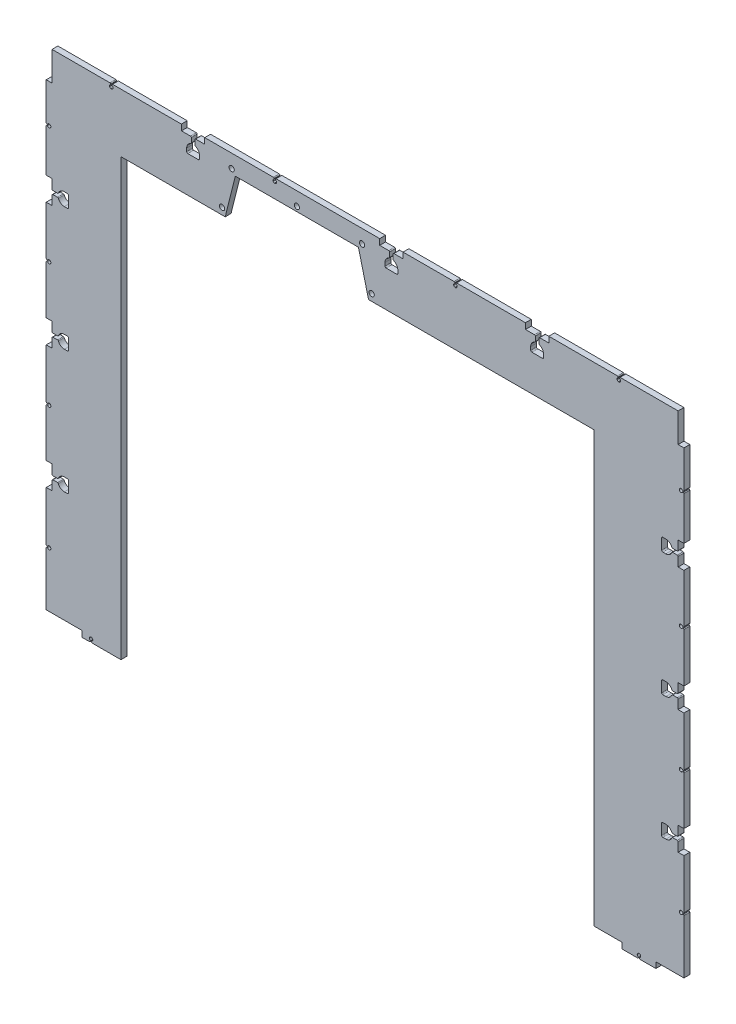
from build123d import *

# Parameters (mm, degrees)
MODEL_R             = 2.249999999
BOSS_EXTRUDE1_DEPTH = 5


with BuildPart() as part:
    # Model → Boss-Extrude1 (new body)
    with BuildSketch(Plane.XY):
        with BuildLine():
            Line((261.307383373, -103.940251976), (291.794615695, -103.940251976))
            Line((291.794615695, -103.940251976), (300.418939293, -138.440626737))
            Line((300.418939293, -138.440626737), (493.467327761, -138.440548814))
            add(Edge.make_bspline(
                [(493.467329423, -506.440295074), (493.467327381, -138.44081783), (493.467327761, -138.440548814)],
                knots=[0, 0, 0, 1, 1, 1], degree=2))
            Line((493.467329423, -506.440295074), (517.493608695, -506.440295074))
            Line((517.493608695, -506.440295074), (517.493608695, -511.440298825))
            Line((517.493608695, -511.440298825), (530.837127105, -511.440298825))
            add(Edge.make_bspline(
                [(531.482013256, -510.796321179), (531.481511649, -511.152126974), (531.192933254, -511.440298825), (530.837127105, -511.440298825)],
                knots=[110, 110, 110, 110, 111, 111, 111, 111], degree=3))
            Line((531.482013256, -510.796321179), (531.482072162, -510.754536748))
            add(Edge.make_bspline(
                [(531.159397004, -510.195408521), (531.352323759, -510.321972355), (531.482397448, -510.523800902), (531.482072162, -510.754536748)],
                knots=[108, 108, 108, 108, 109, 109, 109, 109], degree=3))
            add(Edge.make_bspline(
                [(530.481105329, -508.940296373), (530.481105328, -509.465362542), (530.750887098, -509.927417802), (531.159397004, -510.195408521)],
                knots=[107, 107, 107, 107, 108, 108, 108, 108], degree=3))
            add(Edge.make_bspline(
                [(532.34493913, -507.483075338), (531.358668083, -507.251275912), (530.481105343, -507.993303257), (530.481105329, -508.940296373)],
                knots=[106, 106, 106, 106, 107, 107, 107, 107], degree=3))
            add(Edge.make_bspline(
                [(533.431103461, -508.546960012), (533.298342158, -508.024781271), (532.869439285, -507.606346536), (532.34493913, -507.483075338)],
                knots=[105, 105, 105, 105, 106, 106, 106, 106], degree=3))
            add(Edge.make_bspline(
                [(532.797020473, -510.199189924), (533.308675637, -509.866894504), (533.605051988, -509.231137028), (533.431103461, -508.546960012)],
                knots=[104, 104, 104, 104, 105, 105, 105, 105], degree=3))
            add(Edge.make_bspline(
                [(532.471305327, -510.743247339), (532.477061026, -510.517354827), (532.60751342, -510.322265641), (532.797020473, -510.199189924)],
                knots=[103, 103, 103, 103, 104, 104, 104, 104], degree=3))
            Line((532.471305327, -510.743247339), (532.470394718, -510.77898577))
            add(Edge.make_bspline(
                [(533.115072274, -511.440298825), (532.752478529, -511.440298825), (532.461158895, -511.14146187), (532.470394718, -510.77898577)],
                knots=[101, 101, 101, 101, 102, 102, 102, 102], degree=3))
            Line((533.115072274, -511.440298825), (546.441040064, -511.440298825))
            Line((546.441040064, -511.440298825), (546.441040064, -506.440295074))
            Line((546.441040064, -506.440295074), (570.467319336, -506.440295074))
            Line((570.467319336, -506.440295074), (570.467319336, -460.230990761))
            add(Edge.make_bspline(
                [(569.823341689, -459.586104611), (570.179147485, -459.586606217), (570.467319336, -459.875184612), (570.467319336, -460.230990761)],
                knots=[96, 96, 96, 96, 97, 97, 97, 97], degree=3))
            Line((569.823341689, -459.586104611), (569.781557259, -459.586045704))
            add(Edge.make_bspline(
                [(569.222429032, -459.908720862), (569.348992865, -459.715794108), (569.550821413, -459.585720418), (569.781557259, -459.586045704)],
                knots=[94, 94, 94, 94, 95, 95, 95, 95], degree=3))
            add(Edge.make_bspline(
                [(567.967316884, -460.587012538), (568.492383052, -460.587012538), (568.954438313, -460.317230769), (569.222429032, -459.908720862)],
                knots=[93, 93, 93, 93, 94, 94, 94, 94], degree=3))
            add(Edge.make_bspline(
                [(566.510095848, -458.723178737), (566.278296423, -459.709449783), (567.020323768, -460.587012523), (567.967316884, -460.587012538)],
                knots=[92, 92, 92, 92, 93, 93, 93, 93], degree=3))
            add(Edge.make_bspline(
                [(567.573980523, -457.637014405), (567.051801782, -457.769775708), (566.633367046, -458.198678582), (566.510095848, -458.723178737)],
                knots=[91, 91, 91, 91, 92, 92, 92, 92], degree=3))
            add(Edge.make_bspline(
                [(569.226210435, -458.271097394), (568.893915014, -457.75944223), (568.258157539, -457.463065879), (567.573980523, -457.637014405)],
                knots=[90, 90, 90, 90, 91, 91, 91, 91], degree=3))
            add(Edge.make_bspline(
                [(569.77026785, -458.59681254), (569.544375337, -458.59105684), (569.349286151, -458.460604447), (569.226210435, -458.271097394)],
                knots=[89, 89, 89, 89, 90, 90, 90, 90], degree=3))
            Line((569.77026785, -458.59681254), (569.80600628, -458.597723148))
            add(Edge.make_bspline(
                [(570.467319336, -457.953045593), (570.467319335, -458.315639337), (570.168482381, -458.606958972), (569.80600628, -458.597723148)],
                knots=[87, 87, 87, 87, 88, 88, 88, 88], degree=3))
            Line((570.467319336, -457.953045593), (570.467319336, -415.690300813))
            Line((570.467319336, -415.690300813), (565.467315585, -415.690300813))
            Line((565.467315585, -415.690300813), (565.467315585, -407.940476253))
            add(Edge.make_bspline(
                [(564.717135104, -407.190476274), (565.131419139, -407.19037658), (565.467315585, -407.526192207), (565.467315585, -407.940476253)],
                knots=[83, 83, 83, 83, 84, 84, 84, 84], degree=3))
            Line((564.717135104, -407.190476274), (560.792410444, -407.191420726))
            add(Edge.make_bspline(
                [(560.098330941, -407.667876249), (560.209281691, -407.380879009), (560.484713812, -407.191937929), (560.792410444, -407.191420726)],
                knots=[81, 81, 81, 81, 82, 82, 82, 82], degree=3))
            add(Edge.make_bspline(
                [(554.967023746, -411.190296429), (557.296258818, -411.190750194), (559.299688603, -409.723730217), (560.098330941, -407.667876249)],
                knots=[80, 80, 80, 80, 81, 81, 81, 81], degree=3))
            Line((554.967023746, -411.190296429), (552.367350814, -411.190296429))
            add(Edge.make_bspline(
                [(551.367350815, -410.190296429), (551.367350814, -410.742581179), (551.815066064, -411.190296429), (552.367350814, -411.190296429)],
                knots=[78, 78, 78, 78, 79, 79, 79, 79], degree=3))
            Line((551.367350815, -410.190296429), (551.367350815, -401.190296432))
            add(Edge.make_bspline(
                [(552.367350815, -400.190296432), (551.815066066, -400.190296432), (551.367350815, -400.638011682), (551.367350815, -401.190296432)],
                knots=[76, 76, 76, 76, 77, 77, 77, 77], degree=3))
            Line((552.367350815, -400.190296432), (554.967023748, -400.190296432))
            add(Edge.make_bspline(
                [(560.09867297, -403.713453342), (559.300215856, -401.657193959), (557.296556675, -400.189819001), (554.967023748, -400.190296432)],
                knots=[74, 74, 74, 74, 75, 75, 75, 75], degree=3))
            add(Edge.make_bspline(
                [(560.792910551, -404.190085283), (560.485111766, -404.189605123), (560.209594602, -404.000571287), (560.09867297, -403.713453342)],
                knots=[73, 73, 73, 73, 74, 74, 74, 74], degree=3))
            Line((560.792910551, -404.190085283), (564.717281798, -404.190262075))
            add(Edge.make_bspline(
                [(565.467315585, -403.440262076), (565.467315584, -403.854488833), (565.131508554, -404.190280735), (564.717281798, -404.190262075)],
                knots=[71, 71, 71, 71, 72, 72, 72, 72], degree=3))
            Line((565.467315585, -403.440262076), (565.467315585, -395.690292049))
            Line((565.467315585, -395.690292049), (570.467319336, -395.690292049))
            Line((570.467319336, -395.690292049), (570.467319336, -354.480989822))
            add(Edge.make_bspline(
                [(569.823341689, -353.836103671), (570.179147485, -353.836605277), (570.467319336, -354.125183673), (570.467319336, -354.480989822)],
                knots=[67, 67, 67, 67, 68, 68, 68, 68], degree=3))
            Line((569.823341689, -353.836103671), (569.781557259, -353.836044764))
            add(Edge.make_bspline(
                [(569.222429032, -354.158719922), (569.348992865, -353.965793168), (569.550821413, -353.835719479), (569.781557259, -353.836044764)],
                knots=[65, 65, 65, 65, 66, 66, 66, 66], degree=3))
            add(Edge.make_bspline(
                [(567.967316884, -354.837011598), (568.492383052, -354.837011598), (568.954438313, -354.567229829), (569.222429032, -354.158719922)],
                knots=[64, 64, 64, 64, 65, 65, 65, 65], degree=3))
            add(Edge.make_bspline(
                [(566.510093031, -352.97318), (566.278295097, -353.959451397), (567.020323768, -354.837013015), (567.967316884, -354.837011598)],
                knots=[63, 63, 63, 63, 64, 64, 64, 64], degree=3))
            add(Edge.make_bspline(
                [(567.573980523, -351.887018428), (567.051801438, -352.019778376), (566.633365589, -352.448680165), (566.510093031, -352.97318)],
                knots=[62, 62, 62, 62, 63, 63, 63, 63], degree=3))
            add(Edge.make_bspline(
                [(569.226210435, -352.521101417), (568.893915014, -352.009446253), (568.258157539, -351.713069901), (567.573980523, -351.887018428)],
                knots=[61, 61, 61, 61, 62, 62, 62, 62], degree=3))
            add(Edge.make_bspline(
                [(569.77026785, -352.846816562), (569.544375337, -352.841060863), (569.349286151, -352.71060847), (569.226210435, -352.521101417)],
                knots=[60, 60, 60, 60, 61, 61, 61, 61], degree=3))
            Line((569.77026785, -352.846816562), (569.80600628, -352.847727171))
            add(Edge.make_bspline(
                [(570.467319336, -352.203049615), (570.467319335, -352.56564336), (570.168482381, -352.856962994), (569.80600628, -352.847727171)],
                knots=[58, 58, 58, 58, 59, 59, 59, 59], degree=3))
            Line((570.467319336, -352.203049615), (570.467319336, -309.940304836))
            Line((570.467319336, -309.940304836), (565.467315585, -309.940304836))
            Line((565.467315585, -309.940304836), (565.467315585, -302.190480276))
            add(Edge.make_bspline(
                [(564.717135106, -301.440480295), (565.13141914, -301.440380602), (565.467315586, -301.776196229), (565.467315585, -302.190480276)],
                knots=[54, 54, 54, 54, 55, 55, 55, 55], degree=3))
            Line((564.717135106, -301.440480295), (560.792410444, -301.441417852))
            add(Edge.make_bspline(
                [(560.098330941, -301.917873374), (560.209281691, -301.630876135), (560.484713812, -301.441935055), (560.792410444, -301.441417852)],
                knots=[52, 52, 52, 52, 53, 53, 53, 53], degree=3))
            add(Edge.make_bspline(
                [(554.967023746, -305.440293555), (557.296258818, -305.44074732), (559.299688603, -303.973727343), (560.098330941, -301.917873374)],
                knots=[51, 51, 51, 51, 52, 52, 52, 52], degree=3))
            Line((554.967023746, -305.440293555), (552.367350814, -305.440293555))
            add(Edge.make_bspline(
                [(551.367350815, -304.440293555), (551.367350814, -304.992578304), (551.815066064, -305.440293555), (552.367350814, -305.440293555)],
                knots=[49, 49, 49, 49, 50, 50, 50, 50], degree=3))
            Line((551.367350815, -304.440293555), (551.367350815, -295.440293557))
            add(Edge.make_bspline(
                [(552.367357712, -294.440300455), (551.815072963, -294.440296646), (551.367354624, -294.888008808), (551.367350815, -295.440293557)],
                knots=[47, 47, 47, 47, 48, 48, 48, 48], degree=3))
            Line((552.367357712, -294.440300455), (554.967030644, -294.440300455))
            add(Edge.make_bspline(
                [(560.098679867, -297.963457364), (559.300222753, -295.907197982), (557.296563571, -294.439823024), (554.967030644, -294.440300455)],
                knots=[45, 45, 45, 45, 46, 46, 46, 46], degree=3))
            add(Edge.make_bspline(
                [(560.792917448, -298.440089305), (560.485118663, -298.439609146), (560.209601499, -298.250575309), (560.098679867, -297.963457364)],
                knots=[44, 44, 44, 44, 45, 45, 45, 45], degree=3))
            Line((560.792917448, -298.440089305), (564.717288694, -298.440266098))
            add(Edge.make_bspline(
                [(565.467315585, -297.690259202), (565.467319394, -298.104485959), (565.131515451, -298.440280949), (564.717288694, -298.440266098)],
                knots=[42, 42, 42, 42, 43, 43, 43, 43], degree=3))
            Line((565.467315585, -297.690259202), (565.467315585, -289.940289175))
            Line((565.467315585, -289.940289175), (570.467319336, -289.940289175))
            Line((570.467319336, -289.940289175), (570.467319336, -248.105989517))
            add(Edge.make_bspline(
                [(569.823341689, -247.461103366), (570.179147485, -247.461604972), (570.467319336, -247.750183368), (570.467319336, -248.105989517)],
                knots=[38, 38, 38, 38, 39, 39, 39, 39], degree=3))
            Line((569.823341689, -247.461103366), (569.781557259, -247.461044459))
            add(Edge.make_bspline(
                [(569.222429032, -247.783719617), (569.348992865, -247.590792863), (569.550821413, -247.460719174), (569.781557259, -247.461044459)],
                knots=[36, 36, 36, 36, 37, 37, 37, 37], degree=3))
            add(Edge.make_bspline(
                [(567.967316884, -248.462011293), (568.492383052, -248.462011293), (568.954438313, -248.192229524), (569.222429032, -247.783719617)],
                knots=[35, 35, 35, 35, 36, 36, 36, 36], degree=3))
            add(Edge.make_bspline(
                [(566.510095848, -246.598177492), (566.278296423, -247.584448539), (567.020323768, -248.462011279), (567.967316884, -248.462011293)],
                knots=[34, 34, 34, 34, 35, 35, 35, 35], degree=3))
            add(Edge.make_bspline(
                [(567.573980523, -245.512013161), (567.051801782, -245.644774463), (566.633367046, -246.073677337), (566.510095848, -246.598177492)],
                knots=[33, 33, 33, 33, 34, 34, 34, 34], degree=3))
            add(Edge.make_bspline(
                [(569.226210435, -246.146096149), (568.893915014, -245.634440985), (568.258157539, -245.338064634), (567.573980523, -245.512013161)],
                knots=[32, 32, 32, 32, 33, 33, 33, 33], degree=3))
            add(Edge.make_bspline(
                [(569.77026785, -246.471811295), (569.544375337, -246.466055596), (569.349286151, -246.335603202), (569.226210435, -246.146096149)],
                knots=[31, 31, 31, 31, 32, 32, 32, 32], degree=3))
            Line((569.77026785, -246.471811295), (569.80600628, -246.472721903))
            add(Edge.make_bspline(
                [(570.467319336, -245.828044348), (570.467319335, -246.190638093), (570.168482381, -246.481957727), (569.80600628, -246.472721903)],
                knots=[29, 29, 29, 29, 30, 30, 30, 30], degree=3))
            Line((570.467319336, -245.828044348), (570.467319336, -204.190304485))
            Line((570.467319336, -204.190304485), (565.467315585, -204.190304485))
            Line((565.467315585, -204.190304485), (565.467315585, -196.440479925))
            add(Edge.make_bspline(
                [(564.717135105, -195.690479945), (565.131419139, -195.690380252), (565.467315586, -196.026195879), (565.467315585, -196.440479925)],
                knots=[25, 25, 25, 25, 26, 26, 26, 26], degree=3))
            Line((564.717135105, -195.690479945), (560.792410444, -195.69142137))
            add(Edge.make_bspline(
                [(560.098330941, -196.167876893), (560.209281691, -195.880879653), (560.484713812, -195.691938573), (560.792410444, -195.69142137)],
                knots=[23, 23, 23, 23, 24, 24, 24, 24], degree=3))
            add(Edge.make_bspline(
                [(554.967023746, -199.690297073), (557.296258818, -199.690750838), (559.299688603, -198.223730861), (560.098330941, -196.167876893)],
                knots=[22, 22, 22, 22, 23, 23, 23, 23], degree=3))
            Line((554.967023746, -199.690297073), (552.367350814, -199.690297073))
            add(Edge.make_bspline(
                [(551.367350815, -198.690297073), (551.367350814, -199.242581823), (551.815066064, -199.690297073), (552.367350814, -199.690297073)],
                knots=[20, 20, 20, 20, 21, 21, 21, 21], degree=3))
            Line((551.367350815, -198.690297073), (551.367350815, -189.690297076))
            add(Edge.make_bspline(
                [(552.367353843, -188.690300104), (551.815069094, -188.690298432), (551.367352487, -189.138012326), (551.367350815, -189.690297076)],
                knots=[18, 18, 18, 18, 19, 19, 19, 19], degree=3))
            Line((552.367353843, -188.690300104), (554.967026775, -188.690300104))
            add(Edge.make_bspline(
                [(560.098675998, -192.213457014), (559.300218884, -190.157197631), (557.296559703, -188.689822673), (554.967026775, -188.690300104)],
                knots=[16, 16, 16, 16, 17, 17, 17, 17], degree=3))
            add(Edge.make_bspline(
                [(560.792913579, -192.690088955), (560.485114794, -192.689608795), (560.20959763, -192.500574959), (560.098675998, -192.213457014)],
                knots=[15, 15, 15, 15, 16, 16, 16, 16], degree=3))
            Line((560.792913579, -192.690088955), (564.717284826, -192.690265747))
            add(Edge.make_bspline(
                [(565.467315585, -191.94026272), (565.467317257, -192.354489477), (565.131511582, -192.690282735), (564.717284826, -192.690265747)],
                knots=[13, 13, 13, 13, 14, 14, 14, 14], degree=3))
            Line((565.467315585, -191.94026272), (565.467315585, -184.190292693))
            Line((565.467315585, -184.190292693), (570.467319336, -184.190292693))
            Line((570.467319336, -184.190292693), (570.467319336, -147.355988462))
            add(Edge.make_bspline(
                [(569.823341689, -146.711102312), (570.179147485, -146.711603918), (570.467319336, -147.000182314), (570.467319336, -147.355988462)],
                knots=[9, 9, 9, 9, 10, 10, 10, 10], degree=3))
            Line((569.823341689, -146.711102312), (569.781557259, -146.711043405))
            add(Edge.make_bspline(
                [(569.222429032, -147.033718563), (569.348992865, -146.840791809), (569.550821413, -146.710718119), (569.781557259, -146.711043405)],
                knots=[7, 7, 7, 7, 8, 8, 8, 8], degree=3))
            add(Edge.make_bspline(
                [(567.967316884, -147.712010239), (568.492383052, -147.712010239), (568.954438313, -147.44222847), (569.222429032, -147.033718563)],
                knots=[6, 6, 6, 6, 7, 7, 7, 7], degree=3))
            add(Edge.make_bspline(
                [(566.510095848, -145.848176438), (566.278296423, -146.834447485), (567.020323768, -147.712010225), (567.967316884, -147.712010239)],
                knots=[5, 5, 5, 5, 6, 6, 6, 6], degree=3))
            add(Edge.make_bspline(
                [(567.573980523, -144.762012107), (567.051801782, -144.894773409), (566.633367046, -145.323676283), (566.510095848, -145.848176438)],
                knots=[4, 4, 4, 4, 5, 5, 5, 5], degree=3))
            add(Edge.make_bspline(
                [(569.226210435, -145.396095095), (568.893915014, -144.884439931), (568.258157539, -144.58806358), (567.573980523, -144.762012107)],
                knots=[3, 3, 3, 3, 4, 4, 4, 4], degree=3))
            add(Edge.make_bspline(
                [(569.77026785, -145.721810241), (569.544375337, -145.716054542), (569.349286151, -145.585602148), (569.226210435, -145.396095095)],
                knots=[2, 2, 2, 2, 3, 3, 3, 3], degree=3))
            Line((569.77026785, -145.721810241), (569.80600628, -145.722720849))
            add(Edge.make_bspline(
                [(570.467319336, -145.078043294), (570.467319335, -145.440637039), (570.168482381, -145.731956673), (569.80600628, -145.722720849)],
                knots=[0, 0, 0, 0, 1, 1, 1, 1], degree=3))
            Line((570.467319336, -145.078043294), (570.467319336, -113.388526066))
            Line((570.467319336, -113.388526066), (565.467315585, -113.388526066))
            Line((565.467315585, -113.388526066), (565.467315585, -88.440292958))
            Line((565.467315585, -88.440292958), (515.847502835, -88.440292958))
            add(Edge.make_bspline(
                [(515.847502835, -88.440292958), (515.491696686, -88.440292958), (515.203118291, -88.728464809), (515.202616685, -89.084270604)],
                knots=[0, 0, 0, 0, 1, 1, 1, 1], degree=3))
            Line((515.202616685, -89.084270604), (515.202557778, -89.126055035))
            add(Edge.make_bspline(
                [(515.202557778, -89.126055035), (515.202232492, -89.356790881), (515.332306182, -89.558619428), (515.525232936, -89.685183262)],
                knots=[2, 2, 2, 2, 3, 3, 3, 3], degree=3))
            add(Edge.make_bspline(
                [(515.525232936, -89.685183262), (515.933742843, -89.953173981), (516.203524612, -90.415229241), (516.203524612, -90.94029541)],
                knots=[3, 3, 3, 3, 4, 4, 4, 4], degree=3))
            add(Edge.make_bspline(
                [(516.203524612, -90.94029541), (516.203524598, -91.887288525), (515.325961858, -92.62931587), (514.339690811, -92.397516445)],
                knots=[4, 4, 4, 4, 5, 5, 5, 5], degree=3))
            add(Edge.make_bspline(
                [(514.339690811, -92.397516445), (513.815190656, -92.274245247), (513.386287782, -91.855810511), (513.25352648, -91.333631771)],
                knots=[5, 5, 5, 5, 6, 6, 6, 6], degree=3))
            add(Edge.make_bspline(
                [(513.25352648, -91.333631771), (513.079577953, -90.649454755), (513.375954304, -90.013697279), (513.887609468, -89.681401859)],
                knots=[6, 6, 6, 6, 7, 7, 7, 7], degree=3))
            add(Edge.make_bspline(
                [(513.887609468, -89.681401859), (514.077116521, -89.558326142), (514.207568914, -89.363236956), (514.213324614, -89.137344444)],
                knots=[7, 7, 7, 7, 8, 8, 8, 8], degree=3))
            Line((514.213324614, -89.137344444), (514.214235222, -89.101606013))
            add(Edge.make_bspline(
                [(514.214235222, -89.101606013), (514.223471046, -88.739129913), (513.932151411, -88.440292958), (513.569557666, -88.440292958)],
                knots=[9, 9, 9, 9, 10, 10, 10, 10], degree=3))
            Line((513.569557666, -88.440292958), (454.740916037, -88.440292958))
            Line((454.740916037, -88.440292958), (454.740916037, -93.440296709))
            Line((454.740916037, -93.440296709), (446.991091477, -93.440296709))
            add(Edge.make_bspline(
                [(446.991091477, -93.440296709), (446.57680743, -93.44029671), (446.240991805, -93.776193157), (446.2410915, -94.190477192)],
                knots=[13, 13, 13, 13, 14, 14, 14, 14], degree=3))
            Line((446.2410915, -94.190477192), (446.242035952, -98.115201852))
            add(Edge.make_bspline(
                [(446.242035952, -98.115201852), (446.242109997, -98.422899229), (446.430654388, -98.698603471), (446.717491832, -98.809967567)],
                knots=[15, 15, 15, 15, 16, 16, 16, 16], degree=3))
            add(Edge.make_bspline(
                [(446.717491832, -98.809967567), (448.773501386, -99.608209398), (450.240911657, -101.611353387), (450.240911658, -103.940588548)],
                knots=[16, 16, 16, 16, 17, 17, 17, 17], degree=3))
            Line((450.240911658, -103.940588548), (450.240911658, -106.54026148))
            add(Edge.make_bspline(
                [(450.240911658, -106.54026148), (450.240911658, -107.09254623), (449.793196408, -107.54026148), (449.240911658, -107.54026148)],
                knots=[18, 18, 18, 18, 19, 19, 19, 19], degree=3))
            Line((449.240911658, -107.54026148), (440.240911661, -107.54026148))
            add(Edge.make_bspline(
                [(440.240911661, -107.54026148), (439.688626911, -107.54026148), (439.240911661, -107.09254623), (439.240911661, -106.54026148)],
                knots=[20, 20, 20, 20, 21, 21, 21, 21], degree=3))
            Line((439.240911661, -106.54026148), (439.240911661, -103.940588548))
            add(Edge.make_bspline(
                [(439.240911661, -103.940588548), (439.240434229, -101.611055621), (440.707809186, -99.607396438), (442.764068568, -98.808939323)],
                knots=[22, 22, 22, 22, 23, 23, 23, 23], degree=3))
            add(Edge.make_bspline(
                [(442.764068568, -98.808939323), (443.051186513, -98.698017691), (443.240220349, -98.422500527), (443.240700509, -98.114701742)],
                knots=[23, 23, 23, 23, 24, 24, 24, 24], degree=3))
            Line((443.240700509, -98.114701742), (443.240877299, -94.190330496))
            add(Edge.make_bspline(
                [(443.240877299, -94.190330496), (443.240895959, -93.776103739), (442.905104057, -93.440296709), (442.4908773, -93.440296709)],
                knots=[25, 25, 25, 25, 26, 26, 26, 26], degree=3))
            Line((442.4908773, -93.440296709), (434.740907273, -93.440296709))
            Line((434.740907273, -93.440296709), (434.740907273, -88.440292958))
            Line((434.740907273, -88.440292958), (375.894710946, -88.38852732))
            add(Edge.make_bspline(
                [(375.894710946, -88.38852732), (375.538904797, -88.388527319), (375.250326402, -88.676699171), (375.249824796, -89.032504966)],
                knots=[29, 29, 29, 29, 30, 30, 30, 30], degree=3))
            Line((375.249824796, -89.032504966), (375.249765889, -89.074289396))
            add(Edge.make_bspline(
                [(375.249765889, -89.074289396), (375.249440603, -89.305025242), (375.379514293, -89.50685379), (375.572441047, -89.633417623)],
                knots=[31, 31, 31, 31, 32, 32, 32, 32], degree=3))
            add(Edge.make_bspline(
                [(375.572441047, -89.633417623), (375.980950954, -89.901408343), (376.250732723, -90.363463603), (376.250732723, -90.888529771)],
                knots=[32, 32, 32, 32, 33, 33, 33, 33], degree=3))
            add(Edge.make_bspline(
                [(376.250732723, -90.888529771), (376.250732709, -91.835522887), (375.373169969, -92.577550232), (374.386898922, -92.345750807)],
                knots=[33, 33, 33, 33, 34, 34, 34, 34], degree=3))
            add(Edge.make_bspline(
                [(374.386898922, -92.345750807), (373.862398767, -92.222479609), (373.433495893, -91.804044873), (373.300734591, -91.281866132)],
                knots=[34, 34, 34, 34, 35, 35, 35, 35], degree=3))
            add(Edge.make_bspline(
                [(373.300734591, -91.281866132), (373.126786064, -90.597689116), (373.423162415, -89.961931641), (373.934817579, -89.62963622)],
                knots=[35, 35, 35, 35, 36, 36, 36, 36], degree=3))
            add(Edge.make_bspline(
                [(373.934817579, -89.62963622), (374.124324632, -89.506560504), (374.254777025, -89.311471318), (374.260532725, -89.085578805)],
                knots=[36, 36, 36, 36, 37, 37, 37, 37], degree=3))
            Line((374.260532725, -89.085578805), (374.261443333, -89.049840375))
            add(Edge.make_bspline(
                [(374.261443333, -89.049840375), (374.270679157, -88.687364274), (373.979359522, -88.38852732), (373.616765777, -88.38852732)],
                knots=[38, 38, 38, 38, 39, 39, 39, 39], degree=3))
            Line((373.616765777, -88.38852732), (329.968017059, -88.440292958))
            Line((329.968017059, -88.440292958), (329.968017059, -93.440296709))
            Line((329.968017059, -93.440296709), (322.21817954, -93.440296709))
            add(Edge.make_bspline(
                [(322.21817954, -93.440296709), (321.803895493, -93.44029671), (321.468079868, -93.776193157), (321.468179563, -94.190477192)],
                knots=[42, 42, 42, 42, 43, 43, 43, 43], degree=3))
            Line((321.468179563, -94.190477192), (321.469124015, -98.115201852))
            add(Edge.make_bspline(
                [(321.469124015, -98.115201852), (321.46919806, -98.422899229), (321.657742451, -98.698603471), (321.944579895, -98.809967567)],
                knots=[44, 44, 44, 44, 45, 45, 45, 45], degree=3))
            add(Edge.make_bspline(
                [(321.944579895, -98.809967567), (324.000589449, -99.608209398), (325.46799972, -101.611353387), (325.467999721, -103.940588548)],
                knots=[45, 45, 45, 45, 46, 46, 46, 46], degree=3))
            Line((325.467999721, -103.940588548), (325.467999721, -106.54026148))
            add(Edge.make_bspline(
                [(325.467999721, -106.54026148), (325.467999721, -107.09254623), (325.020284471, -107.54026148), (324.467999721, -107.54026148)],
                knots=[47, 47, 47, 47, 48, 48, 48, 48], degree=3))
            Line((324.467999721, -107.54026148), (315.467999724, -107.54026148))
            add(Edge.make_bspline(
                [(315.467999724, -107.54026148), (314.915714974, -107.54026148), (314.467999724, -107.09254623), (314.467999724, -106.54026148)],
                knots=[49, 49, 49, 49, 50, 50, 50, 50], degree=3))
            Line((314.467999724, -106.54026148), (314.467999724, -103.940588548))
            add(Edge.make_bspline(
                [(314.467999724, -103.940588548), (314.467522292, -101.611055621), (315.934897248, -99.607396438), (317.991156631, -98.808939323)],
                knots=[51, 51, 51, 51, 52, 52, 52, 52], degree=3))
            add(Edge.make_bspline(
                [(317.991156631, -98.808939323), (318.278274576, -98.698017691), (318.467308412, -98.422500527), (318.467788571, -98.114701742)],
                knots=[52, 52, 52, 52, 53, 53, 53, 53], degree=3))
            Line((318.467788571, -98.114701742), (318.467965361, -94.190330496))
            add(Edge.make_bspline(
                [(318.467965361, -94.190330496), (318.467984022, -93.776103739), (318.132192119, -93.440296709), (317.717965363, -93.440296709)],
                knots=[54, 54, 54, 54, 55, 55, 55, 55], degree=3))
            Line((317.717965363, -93.440296709), (309.968008801, -93.440296709))
            Line((309.968008801, -93.440296709), (309.968008801, -88.440292958))
            Line((309.968008801, -88.440292958), (259.896045785, -88.440292958))
            Line((259.896045785, -88.440292958), (221.300298589, -88.440292958))
            add(Edge.make_bspline(
                [(221.300298589, -88.440292958), (220.94449244, -88.440292958), (220.655914045, -88.728464809), (220.655412438, -89.084270604)],
                knots=[3, 3, 3, 3, 4, 4, 4, 4], degree=3))
            Line((220.655412438, -89.084270604), (220.655353532, -89.126055035))
            add(Edge.make_bspline(
                [(220.655353532, -89.126055035), (220.655028246, -89.356790881), (220.785101935, -89.558619428), (220.97802869, -89.685183262)],
                knots=[5, 5, 5, 5, 6, 6, 6, 6], degree=3))
            add(Edge.make_bspline(
                [(220.97802869, -89.685183262), (221.386538596, -89.953173981), (221.656320366, -90.415229241), (221.656320366, -90.94029541)],
                knots=[6, 6, 6, 6, 7, 7, 7, 7], degree=3))
            add(Edge.make_bspline(
                [(221.656320366, -90.94029541), (221.656320351, -91.887288525), (220.778757611, -92.62931587), (219.792486565, -92.397516445)],
                knots=[7, 7, 7, 7, 8, 8, 8, 8], degree=3))
            add(Edge.make_bspline(
                [(219.792486565, -92.397516445), (219.26798641, -92.274245247), (218.839083536, -91.855810511), (218.706322233, -91.333631771)],
                knots=[8, 8, 8, 8, 9, 9, 9, 9], degree=3))
            add(Edge.make_bspline(
                [(218.706322233, -91.333631771), (218.532373707, -90.649454755), (218.828750058, -90.013697279), (219.340405222, -89.681401859)],
                knots=[9, 9, 9, 9, 10, 10, 10, 10], degree=3))
            add(Edge.make_bspline(
                [(219.340405222, -89.681401859), (219.529912275, -89.558326142), (219.660364668, -89.363236956), (219.666120367, -89.137344444)],
                knots=[10, 10, 10, 10, 11, 11, 11, 11], degree=3))
            Line((219.666120367, -89.137344444), (219.667030976, -89.101606013))
            add(Edge.make_bspline(
                [(219.667030976, -89.101606013), (219.676266799, -88.739129913), (219.384947165, -88.440292958), (219.02235342, -88.440292958)],
                knots=[12, 12, 12, 12, 13, 13, 13, 13], degree=3))
            Line((219.02235342, -88.440292958), (160.193711791, -88.440292958))
            Line((160.193711791, -88.440292958), (160.193711791, -93.440296709))
            Line((160.193711791, -93.440296709), (152.443874271, -93.440296709))
            add(Edge.make_bspline(
                [(152.443874271, -93.440296709), (152.029590225, -93.44029671), (151.6937746, -93.776193157), (151.693874295, -94.190477192)],
                knots=[16, 16, 16, 16, 17, 17, 17, 17], degree=3))
            Line((151.693874295, -94.190477192), (151.694818747, -98.115201852))
            add(Edge.make_bspline(
                [(151.694818747, -98.115201852), (151.694892792, -98.422899229), (151.883437183, -98.698603471), (152.170274626, -98.809967567)],
                knots=[18, 18, 18, 18, 19, 19, 19, 19], degree=3))
            add(Edge.make_bspline(
                [(152.170274626, -98.809967567), (154.226284181, -99.608209398), (155.693694452, -101.611353387), (155.693694452, -103.940588548)],
                knots=[19, 19, 19, 19, 20, 20, 20, 20], degree=3))
            Line((155.693694452, -103.940588548), (155.693694452, -106.54026148))
            add(Edge.make_bspline(
                [(155.693694452, -106.54026148), (155.693694453, -107.09254623), (155.245979202, -107.54026148), (154.693694452, -107.54026148)],
                knots=[21, 21, 21, 21, 22, 22, 22, 22], degree=3))
            Line((154.693694452, -107.54026148), (145.693694455, -107.54026148))
            add(Edge.make_bspline(
                [(145.693694455, -107.54026148), (145.141409706, -107.54026148), (144.693694456, -107.09254623), (144.693694456, -106.54026148)],
                knots=[23, 23, 23, 23, 24, 24, 24, 24], degree=3))
            Line((144.693694456, -106.54026148), (144.693694456, -103.940588548))
            add(Edge.make_bspline(
                [(144.693694456, -103.940588548), (144.693694457, -101.611055523), (146.161480059, -99.607697076), (148.217903084, -98.809661387)],
                knots=[25, 25, 25, 25, 26, 26, 26, 26], degree=3))
            add(Edge.make_bspline(
                [(148.217903084, -98.809661387), (148.50485299, -98.698304792), (148.693469437, -98.422501254), (148.693483303, -98.114701742)],
                knots=[26, 26, 26, 26, 27, 27, 27, 27], degree=3))
            Line((148.693483303, -98.114701742), (148.693660093, -94.190330496))
            add(Edge.make_bspline(
                [(148.693660093, -94.190330496), (148.693678754, -93.776103739), (148.357886851, -93.440296709), (147.943660094, -93.440296709)],
                knots=[28, 28, 28, 28, 29, 29, 29, 29], degree=3))
            Line((147.943660094, -93.440296709), (140.193703533, -93.440296709))
            Line((140.193703533, -93.440296709), (140.193703533, -88.440292958))
            Line((140.193703533, -88.440292958), (81.347507206, -88.38852732))
            add(Edge.make_bspline(
                [(81.347507206, -88.38852732), (80.991701057, -88.388527319), (80.703122662, -88.676699171), (80.702621055, -89.032504966)],
                knots=[32, 32, 32, 32, 33, 33, 33, 33], degree=3))
            Line((80.702621055, -89.032504966), (80.702562149, -89.074289396))
            add(Edge.make_bspline(
                [(80.702562149, -89.074289396), (80.702236863, -89.305025242), (80.832310552, -89.50685379), (81.025237307, -89.633417623)],
                knots=[34, 34, 34, 34, 35, 35, 35, 35], degree=3))
            add(Edge.make_bspline(
                [(81.025237307, -89.633417623), (81.433747214, -89.901408343), (81.703528983, -90.363463603), (81.703528983, -90.888529771)],
                knots=[35, 35, 35, 35, 36, 36, 36, 36], degree=3))
            add(Edge.make_bspline(
                [(81.703528983, -90.888529771), (81.703528968, -91.835522887), (80.825966228, -92.577550232), (79.839695182, -92.345750807)],
                knots=[36, 36, 36, 36, 37, 37, 37, 37], degree=3))
            add(Edge.make_bspline(
                [(79.839695182, -92.345750807), (79.315195027, -92.222479609), (78.886292153, -91.804044873), (78.75353085, -91.281866132)],
                knots=[37, 37, 37, 37, 38, 38, 38, 38], degree=3))
            add(Edge.make_bspline(
                [(78.75353085, -91.281866132), (78.579582324, -90.597689116), (78.875958675, -89.961931641), (79.387613839, -89.62963622)],
                knots=[38, 38, 38, 38, 39, 39, 39, 39], degree=3))
            add(Edge.make_bspline(
                [(79.387613839, -89.62963622), (79.577120892, -89.506560504), (79.707573285, -89.311471318), (79.713328984, -89.085578805)],
                knots=[39, 39, 39, 39, 40, 40, 40, 40], degree=3))
            Line((79.713328984, -89.085578805), (79.714239593, -89.049840375))
            add(Edge.make_bspline(
                [(79.714239593, -89.049840375), (79.723475416, -88.687364274), (79.432155782, -88.38852732), (79.069562037, -88.38852732)],
                knots=[41, 41, 41, 41, 42, 42, 42, 42], degree=3))
            Line((79.069562037, -88.38852732), (29.467317209, -88.38852732))
            Line((29.467317209, -88.38852732), (29.467317209, -113.388526066))
            Line((29.467317209, -113.388526066), (24.467313458, -113.388526066))
            Line((24.467313458, -113.388526066), (24.467313458, -145.185096014))
            add(Edge.make_bspline(
                [(25.111291105, -145.829982164), (24.755485309, -145.829480558), (24.467313458, -145.540902162), (24.467313458, -145.185096014)],
                knots=[115, 115, 115, 115, 116, 116, 116, 116], degree=3))
            Line((25.111291105, -145.829982164), (25.153075535, -145.830041071))
            add(Edge.make_bspline(
                [(25.712203762, -145.507365913), (25.585639929, -145.700292667), (25.383811381, -145.830366357), (25.153075535, -145.830041071)],
                knots=[113, 113, 113, 113, 114, 114, 114, 114], degree=3))
            add(Edge.make_bspline(
                [(26.96731591, -144.829074237), (26.442249742, -144.829074237), (25.980194481, -145.098856006), (25.712203762, -145.507365913)],
                knots=[112, 112, 112, 112, 113, 113, 113, 113], degree=3))
            add(Edge.make_bspline(
                [(28.424536945, -146.692908038), (28.656336371, -145.706636991), (27.914309026, -144.829074251), (26.96731591, -144.829074237)],
                knots=[111, 111, 111, 111, 112, 112, 112, 112], degree=3))
            add(Edge.make_bspline(
                [(27.360652271, -147.779072369), (27.882831012, -147.646311067), (28.301265748, -147.217408193), (28.424536945, -146.692908038)],
                knots=[110, 110, 110, 110, 111, 111, 111, 111], degree=3))
            add(Edge.make_bspline(
                [(25.708422359, -147.144989381), (26.04071778, -147.656644545), (26.676475255, -147.953020896), (27.360652271, -147.779072369)],
                knots=[109, 109, 109, 109, 110, 110, 110, 110], degree=3))
            add(Edge.make_bspline(
                [(25.164364944, -146.819274235), (25.390257456, -146.825029934), (25.585346642, -146.955482328), (25.708422359, -147.144989381)],
                knots=[108, 108, 108, 108, 109, 109, 109, 109], degree=3))
            Line((25.164364944, -146.819274235), (25.128626513, -146.818363627))
            add(Edge.make_bspline(
                [(24.467313458, -147.463041182), (24.467313459, -147.100447437), (24.766150413, -146.809127803), (25.128626513, -146.818363627)],
                knots=[106, 106, 106, 106, 107, 107, 107, 107], degree=3))
            Line((24.467313458, -147.463041182), (24.467313458, -184.190292693))
            Line((24.467313458, -184.190292693), (29.467317209, -184.190292693))
            Line((29.467317209, -184.190292693), (29.467317209, -191.940117253))
            add(Edge.make_bspline(
                [(30.217497689, -192.690117233), (29.803213655, -192.690216926), (29.467317209, -192.3544013), (29.467317209, -191.940117253)],
                knots=[102, 102, 102, 102, 103, 103, 103, 103], degree=3))
            Line((30.217497689, -192.690117233), (34.142222351, -192.689175808))
            add(Edge.make_bspline(
                [(34.836988065, -192.213719929), (34.725623969, -192.500557372), (34.449919727, -192.689101763), (34.142222351, -192.689175808)],
                knots=[100, 100, 100, 100, 101, 101, 101, 101], degree=3))
            add(Edge.make_bspline(
                [(39.967609048, -188.690300104), (37.638373887, -188.690300104), (35.635229897, -190.157710374), (34.836988065, -192.213719929)],
                knots=[99, 99, 99, 99, 100, 100, 100, 100], degree=3))
            Line((39.967609048, -188.690300104), (42.56728198, -188.690300104))
            add(Edge.make_bspline(
                [(43.567281979, -189.690300105), (43.56728198, -189.138015355), (43.11956673, -188.690300105), (42.56728198, -188.690300104)],
                knots=[97, 97, 97, 97, 98, 98, 98, 98], degree=3))
            Line((43.567281979, -189.690300105), (43.567281979, -198.690300102))
            add(Edge.make_bspline(
                [(42.567278951, -199.690297073), (43.119563701, -199.690298746), (43.567280307, -199.242584852), (43.567281979, -198.690300102)],
                knots=[95, 95, 95, 95, 96, 96, 96, 96], degree=3))
            Line((42.567278951, -199.690297073), (39.967606019, -199.690297073))
            add(Edge.make_bspline(
                [(34.83667886, -196.166088443), (35.634714548, -198.222511468), (37.638072994, -199.690297071), (39.967606019, -199.690297073)],
                knots=[93, 93, 93, 93, 94, 94, 94, 94], degree=3))
            add(Edge.make_bspline(
                [(34.141719215, -195.690508224), (34.449518727, -195.69052209), (34.725322264, -195.879138537), (34.83667886, -196.166088443)],
                knots=[92, 92, 92, 92, 93, 93, 93, 93], degree=3))
            Line((34.141719215, -195.690508224), (30.217347968, -195.690331432))
            add(Edge.make_bspline(
                [(29.467317209, -196.440334458), (29.467315537, -196.026107702), (29.803121212, -195.690314443), (30.217347968, -195.690331432)],
                knots=[90, 90, 90, 90, 91, 91, 91, 91], degree=3))
            Line((29.467317209, -196.440334458), (29.467317209, -204.190304485))
            Line((29.467317209, -204.190304485), (24.467313458, -204.190304485))
            Line((24.467313458, -204.190304485), (24.467313458, -245.935100096))
            add(Edge.make_bspline(
                [(25.111291105, -246.579986246), (24.755485309, -246.57948464), (24.467313458, -246.290906244), (24.467313458, -245.935100096)],
                knots=[86, 86, 86, 86, 87, 87, 87, 87], degree=3))
            Line((25.111291105, -246.579986246), (25.153075535, -246.580045153))
            add(Edge.make_bspline(
                [(25.712203762, -246.257369995), (25.585639929, -246.450296749), (25.383811381, -246.580370439), (25.153075535, -246.580045153)],
                knots=[84, 84, 84, 84, 85, 85, 85, 85], degree=3))
            add(Edge.make_bspline(
                [(26.96731591, -245.579078319), (26.442249742, -245.579078319), (25.980194481, -245.848860088), (25.712203762, -246.257369995)],
                knots=[83, 83, 83, 83, 84, 84, 84, 84], degree=3))
            add(Edge.make_bspline(
                [(28.424536945, -247.44291212), (28.656336371, -246.456641073), (27.914309026, -245.579078333), (26.96731591, -245.579078319)],
                knots=[82, 82, 82, 82, 83, 83, 83, 83], degree=3))
            add(Edge.make_bspline(
                [(27.360652271, -248.529076451), (27.882831012, -248.396315149), (28.301265748, -247.967412275), (28.424536945, -247.44291212)],
                knots=[81, 81, 81, 81, 82, 82, 82, 82], degree=3))
            add(Edge.make_bspline(
                [(25.708422359, -247.894993463), (26.04071778, -248.406648627), (26.676475255, -248.703024978), (27.360652271, -248.529076451)],
                knots=[80, 80, 80, 80, 81, 81, 81, 81], degree=3))
            add(Edge.make_bspline(
                [(25.164364944, -247.569278317), (25.390257456, -247.575034016), (25.585346642, -247.70548641), (25.708422359, -247.894993463)],
                knots=[79, 79, 79, 79, 80, 80, 80, 80], degree=3))
            Line((25.164364944, -247.569278317), (25.128626513, -247.568367709))
            add(Edge.make_bspline(
                [(24.467313458, -248.213045264), (24.467313459, -247.850451519), (24.766150413, -247.559131885), (25.128626513, -247.568367709)],
                knots=[77, 77, 77, 77, 78, 78, 78, 78], degree=3))
            Line((24.467313458, -248.213045264), (24.467313458, -289.940289175))
            Line((24.467313458, -289.940289175), (29.467317209, -289.940289175))
            Line((29.467317209, -289.940289175), (29.467317209, -297.690113735))
            add(Edge.make_bspline(
                [(30.217497689, -298.440113716), (29.803213654, -298.440213409), (29.467317208, -298.104397782), (29.467317209, -297.690113735)],
                knots=[73, 73, 73, 73, 74, 74, 74, 74], degree=3))
            Line((30.217497689, -298.440113716), (34.142222351, -298.439176159))
            add(Edge.make_bspline(
                [(34.836988065, -297.96372028), (34.725623969, -298.250557723), (34.449919727, -298.439102114), (34.142222351, -298.439176159)],
                knots=[71, 71, 71, 71, 72, 72, 72, 72], degree=3))
            add(Edge.make_bspline(
                [(39.967609048, -294.440300455), (37.638373887, -294.440300455), (35.635229897, -295.907710725), (34.836988065, -297.96372028)],
                knots=[70, 70, 70, 70, 71, 71, 71, 71], degree=3))
            Line((39.967609048, -294.440300455), (42.56728198, -294.440300455))
            add(Edge.make_bspline(
                [(43.567281979, -295.440300456), (43.56728198, -294.888015706), (43.11956673, -294.440300455), (42.56728198, -294.440300455)],
                knots=[68, 68, 68, 68, 69, 69, 69, 69], degree=3))
            Line((43.567281979, -295.440300456), (43.567281979, -304.440300453))
            add(Edge.make_bspline(
                [(42.567275082, -305.440293555), (43.119559832, -305.440297365), (43.56727817, -304.992585203), (43.567281979, -304.440300453)],
                knots=[66, 66, 66, 66, 67, 67, 67, 67], degree=3))
            Line((42.567275082, -305.440293555), (39.96760215, -305.440293555))
            add(Edge.make_bspline(
                [(34.836674991, -301.916084925), (35.634710679, -303.97250795), (37.638069125, -305.440293553), (39.96760215, -305.440293555)],
                knots=[64, 64, 64, 64, 65, 65, 65, 65], degree=3))
            add(Edge.make_bspline(
                [(34.141715346, -301.440504705), (34.449514858, -301.440518572), (34.725318396, -301.629135019), (34.836674991, -301.916084925)],
                knots=[63, 63, 63, 63, 64, 64, 64, 64], degree=3))
            Line((34.141715346, -301.440504705), (30.217344099, -301.440327914))
            add(Edge.make_bspline(
                [(29.467317209, -302.190334809), (29.4673134, -301.776108052), (29.803117343, -301.440313062), (30.217344099, -301.440327914)],
                knots=[61, 61, 61, 61, 62, 62, 62, 62], degree=3))
            Line((29.467317209, -302.190334809), (29.467317209, -309.940304836))
            Line((29.467317209, -309.940304836), (24.467313458, -309.940304836))
            Line((24.467313458, -309.940304836), (24.467313458, -352.310102335))
            add(Edge.make_bspline(
                [(25.111291105, -352.954988486), (24.755485309, -352.954486879), (24.467313458, -352.665908484), (24.467313458, -352.310102335)],
                knots=[57, 57, 57, 57, 58, 58, 58, 58], degree=3))
            Line((25.111291105, -352.954988486), (25.153075535, -352.955047392))
            add(Edge.make_bspline(
                [(25.712203762, -352.632372234), (25.585639929, -352.825298989), (25.383811381, -352.955372678), (25.153075535, -352.955047392)],
                knots=[55, 55, 55, 55, 56, 56, 56, 56], degree=3))
            add(Edge.make_bspline(
                [(26.96731591, -351.954080558), (26.442249742, -351.954080558), (25.980194481, -352.223862328), (25.712203762, -352.632372234)],
                knots=[54, 54, 54, 54, 55, 55, 55, 55], degree=3))
            add(Edge.make_bspline(
                [(28.424539811, -353.817912119), (28.65633772, -352.831640716), (27.914309026, -351.954079117), (26.96731591, -351.954080558)],
                knots=[53, 53, 53, 53, 54, 54, 54, 54], degree=3))
            add(Edge.make_bspline(
                [(27.360652271, -354.904073644), (27.882831362, -354.771313719), (28.301267229, -354.342411949), (28.424539811, -353.817912119)],
                knots=[52, 52, 52, 52, 53, 53, 53, 53], degree=3))
            add(Edge.make_bspline(
                [(25.708422359, -354.269990656), (26.04071778, -354.78164582), (26.676475255, -355.078022171), (27.360652271, -354.904073644)],
                knots=[51, 51, 51, 51, 52, 52, 52, 52], degree=3))
            add(Edge.make_bspline(
                [(25.164364944, -353.94427551), (25.390257456, -353.950031209), (25.585346642, -354.080483603), (25.708422359, -354.269990656)],
                knots=[50, 50, 50, 50, 51, 51, 51, 51], degree=3))
            Line((25.164364944, -353.94427551), (25.128626513, -353.943364902))
            add(Edge.make_bspline(
                [(24.467313458, -354.588042457), (24.467313459, -354.225448712), (24.766150413, -353.934129078), (25.128626513, -353.943364902)],
                knots=[48, 48, 48, 48, 49, 49, 49, 49], degree=3))
            Line((24.467313458, -354.588042457), (24.467313458, -395.690292049))
            Line((24.467313458, -395.690292049), (29.467317209, -395.690292049))
            Line((29.467317209, -395.690292049), (29.467317209, -403.440116609))
            add(Edge.make_bspline(
                [(30.21749769, -404.190116588), (29.803213656, -404.190216282), (29.467317209, -403.854400656), (29.467317209, -403.440116609)],
                knots=[44, 44, 44, 44, 45, 45, 45, 45], degree=3))
            Line((30.21749769, -404.190116588), (34.142222351, -404.189172136))
            add(Edge.make_bspline(
                [(34.836988065, -403.713716257), (34.725623969, -404.0005537), (34.449919727, -404.189098091), (34.142222351, -404.189172136)],
                knots=[42, 42, 42, 42, 43, 43, 43, 43], degree=3))
            add(Edge.make_bspline(
                [(39.967609048, -400.190296432), (37.638373887, -400.190296432), (35.635229897, -401.657706702), (34.836988065, -403.713716257)],
                knots=[41, 41, 41, 41, 42, 42, 42, 42], degree=3))
            Line((39.967609048, -400.190296432), (42.56728198, -400.190296432))
            add(Edge.make_bspline(
                [(43.567281979, -401.190296433), (43.56728198, -400.638011683), (43.11956673, -400.190296433), (42.56728198, -400.190296432)],
                knots=[39, 39, 39, 39, 40, 40, 40, 40], degree=3))
            Line((43.567281979, -401.190296433), (43.567281979, -410.19029643))
            add(Edge.make_bspline(
                [(42.567281979, -411.190296429), (43.119566729, -411.19029643), (43.567281979, -410.74258118), (43.567281979, -410.19029643)],
                knots=[37, 37, 37, 37, 38, 38, 38, 38], degree=3))
            Line((42.567281979, -411.190296429), (39.967609047, -411.190296429))
            add(Edge.make_bspline(
                [(34.836681888, -407.666087799), (35.634717576, -409.722510824), (37.638076022, -411.190296427), (39.967609047, -411.190296429)],
                knots=[35, 35, 35, 35, 36, 36, 36, 36], degree=3))
            add(Edge.make_bspline(
                [(34.141722243, -407.190507579), (34.449521755, -407.190521446), (34.725325292, -407.379137893), (34.836681888, -407.666087799)],
                knots=[34, 34, 34, 34, 35, 35, 35, 35], degree=3))
            Line((34.141722243, -407.190507579), (30.217350996, -407.190330788))
            add(Edge.make_bspline(
                [(29.467317209, -407.940330787), (29.467317209, -407.52610403), (29.80312424, -407.190312127), (30.217350996, -407.190330788)],
                knots=[32, 32, 32, 32, 33, 33, 33, 33], degree=3))
            Line((29.467317209, -407.940330787), (29.467317209, -415.690300813))
            Line((29.467317209, -415.690300813), (24.467313458, -415.690300813))
            Line((24.467313458, -415.690300813), (24.467313458, -458.060098312))
            add(Edge.make_bspline(
                [(25.111291105, -458.704984463), (24.755485309, -458.704482856), (24.467313458, -458.415904461), (24.467313458, -458.060098312)],
                knots=[28, 28, 28, 28, 29, 29, 29, 29], degree=3))
            Line((25.111291105, -458.704984463), (25.153075535, -458.705043363))
            add(Edge.make_bspline(
                [(25.712203762, -458.382368205), (25.585639929, -458.57529496), (25.383811381, -458.705368649), (25.153075535, -458.705043363)],
                knots=[26, 26, 26, 26, 27, 27, 27, 27], degree=3))
            add(Edge.make_bspline(
                [(26.96731591, -457.704076529), (26.442249742, -457.704076529), (25.980194481, -457.973858299), (25.712203762, -458.382368205)],
                knots=[25, 25, 25, 25, 26, 26, 26, 26], degree=3))
            add(Edge.make_bspline(
                [(28.424536973, -459.567910309), (28.656336384, -458.581639259), (27.914309026, -457.70407653), (26.96731591, -457.704076529)],
                knots=[24, 24, 24, 24, 25, 25, 25, 25], degree=3))
            add(Edge.make_bspline(
                [(27.360652272, -460.654074615), (27.882831016, -460.521313325), (28.301265762, -460.092410461), (28.424536973, -459.567910309)],
                knots=[23, 23, 23, 23, 24, 24, 24, 24], degree=3))
            add(Edge.make_bspline(
                [(25.70842236, -460.019991627), (26.040717781, -460.531646791), (26.676475257, -460.828023142), (27.360652272, -460.654074615)],
                knots=[22, 22, 22, 22, 23, 23, 23, 23], degree=3))
            add(Edge.make_bspline(
                [(25.164364946, -459.694276481), (25.390257458, -459.70003218), (25.585346644, -459.830484574), (25.70842236, -460.019991627)],
                knots=[21, 21, 21, 21, 22, 22, 22, 22], degree=3))
            Line((25.164364946, -459.694276481), (25.128626513, -459.693365925))
            add(Edge.make_bspline(
                [(24.467313458, -460.338043481), (24.467313459, -459.975449736), (24.766150413, -459.684130102), (25.128626513, -459.693365925)],
                knots=[19, 19, 19, 19, 20, 20, 20, 20], degree=3))
            Line((24.467313458, -460.338043481), (24.467313458, -506.440295074))
            Line((24.467313458, -506.440295074), (54.96758829, -506.440295074))
            Line((54.96758829, -506.440295074), (54.96758829, -511.588890098))
            Line((54.96758829, -511.588890098), (61.70462229, -511.440298825))
            add(Edge.make_bspline(
                [(62.34950844, -510.796321179), (62.349006834, -511.152126974), (62.060428438, -511.440298825), (61.70462229, -511.440298825)],
                knots=[14, 14, 14, 14, 15, 15, 15, 15], degree=3))
            Line((62.34950844, -510.796321179), (62.349567347, -510.754536748))
            add(Edge.make_bspline(
                [(62.026892189, -510.195408521), (62.219818943, -510.321972355), (62.349892633, -510.523800902), (62.349567347, -510.754536748)],
                knots=[12, 12, 12, 12, 13, 13, 13, 13], degree=3))
            add(Edge.make_bspline(
                [(61.348600513, -508.940296373), (61.348600513, -509.465362542), (61.618382282, -509.927417802), (62.026892189, -510.195408521)],
                knots=[11, 11, 11, 11, 12, 12, 12, 12], degree=3))
            add(Edge.make_bspline(
                [(63.212434314, -507.483075338), (62.226163267, -507.251275912), (61.348600527, -507.993303257), (61.348600513, -508.940296373)],
                knots=[10, 10, 10, 10, 11, 11, 11, 11], degree=3))
            add(Edge.make_bspline(
                [(64.298598645, -508.546960012), (64.165837343, -508.024781271), (63.736934469, -507.606346536), (63.212434314, -507.483075338)],
                knots=[9, 9, 9, 9, 10, 10, 10, 10], degree=3))
            add(Edge.make_bspline(
                [(63.664515657, -510.199189924), (64.176170821, -509.866894504), (64.472547172, -509.231137028), (64.298598645, -508.546960012)],
                knots=[8, 8, 8, 8, 9, 9, 9, 9], degree=3))
            add(Edge.make_bspline(
                [(63.338800511, -510.743247339), (63.34455621, -510.517354827), (63.475008604, -510.322265641), (63.664515657, -510.199189924)],
                knots=[7, 7, 7, 7, 8, 8, 8, 8], degree=3))
            Line((63.338800511, -510.743247339), (63.337889903, -510.77898577))
            add(Edge.make_bspline(
                [(63.982567458, -511.440298825), (63.619973713, -511.440298825), (63.328654079, -511.14146187), (63.337889903, -510.77898577)],
                knots=[5, 5, 5, 5, 6, 6, 6, 6], degree=3))
            Line((63.982567458, -511.440298825), (88.467315624, -511.440298825))
            Line((88.467315624, -511.440298825), (88.467315624, -506.379124137))
            Line((88.467315624, -506.379124137), (88.467315624, -189.050993288))
            Line((88.467315624, -189.050993288), (88.467315624, -138.440383384))
            Line((88.467315624, -138.440383384), (177.731341823, -138.440383384))
            Line((177.731341823, -138.440383384), (186.35611388, -103.940251976))
            Line((186.35611388, -103.940251976), (261.307383373, -103.940251976))
        make_face()
        with Locations((175.039950512, -132.713259018)):
            Circle(MODEL_R, mode=Mode.SUBTRACT)
        with Locations((183.232962717, -99.940384776)):
            Circle(MODEL_R, mode=Mode.SUBTRACT)
        with Locations((239.07536369, -99.940384408)):
            Circle(MODEL_R, mode=Mode.SUBTRACT)
        with Locations((294.917481866, -99.940384408)):
            Circle(MODEL_R, mode=Mode.SUBTRACT)
        with Locations((303.110319423, -132.71241881)):
            Circle(MODEL_R, mode=Mode.SUBTRACT)
    extrude(amount=BOSS_EXTRUDE1_DEPTH)


solid = part.part
